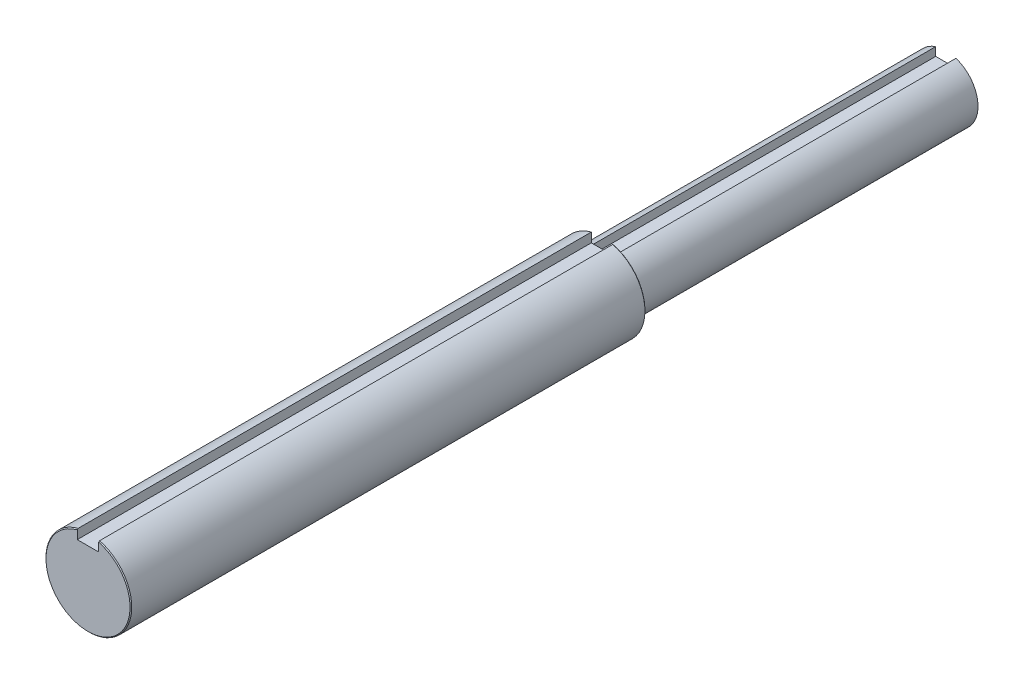
from build123d import *

# Parameters (mm, degrees)
BOSS_EXTRUDE1_DEPTH      = 304.8
BOSS_EXTRUDE1_DEPTH_BACK = 304.8
CHAMFER1_SIZE            = 0.254
SKETCH5_R                = 12.7
SKETCH5_R_2              = 9.525
CUT_EXTRUDE1_DEPTH       = 458.55264178
SKETCH6_W                = 6
SKETCH6_H                = 6
CUT_EXTRUDE2_DEPTH       = 458.55264178
CHAMFER2_SIZE            = 0.2
SKETCH7_R                = 63.5
CUT_EXTRUDE3_DEPTH       = 357.053282529


with BuildPart() as part:
    # Sketch3 → Boss-Extrude1 (new, two sides: drawn at the far end of the back side and taken through both)
    with BuildSketch(Plane.XY.offset(-BOSS_EXTRUDE1_DEPTH_BACK)):
        with BuildLine():
            Line((-3.175, 9.525), (-3.175, 12.296722124))
            ThreePointArc((-3.175, 12.296722124), (0, -12.7), (3.175, 12.296722124))
            Line((3.175, 12.296722124), (3.175, 9.525))
            Line((3.175, 9.525), (-3.175, 9.525))
        make_face()
    extrude(amount=BOSS_EXTRUDE1_DEPTH + BOSS_EXTRUDE1_DEPTH_BACK)

    # Chamfer1
    chamfer1_edges = [part.edges().sort_by_distance(p)[0] for p in [
        (0, -12.7, -304.8),
        (0, -12.7, 304.8),
    ]]
    chamfer(chamfer1_edges, length=CHAMFER1_SIZE)

    # Sketch5 → Cut-Extrude1 (cut, through all)
    with BuildSketch(Plane.XY.offset(152.4)):
        Circle(SKETCH5_R)
        Circle(SKETCH5_R_2, mode=Mode.SUBTRACT)
    extrude(amount=-CUT_EXTRUDE1_DEPTH, mode=Mode.SUBTRACT)

    # Sketch6 → Cut-Extrude2 (cut, through all)
    with BuildSketch(Plane.XY.offset(152.4)):
        with Locations((0, 9.525)):
            Rectangle(SKETCH6_W, SKETCH6_H)
    extrude(amount=-CUT_EXTRUDE2_DEPTH, mode=Mode.SUBTRACT)

    # Chamfer2
    chamfer2_edges = [part.edges().sort_by_distance(p)[0] for p in [
        (-3.175, 10.910861062, 152.4),
        (0, -12.7, 152.4),
        (3.175, 10.910861062, 152.4),
        (0, 9.525, 152.4),
        (0, -9.525, 152.4),
        (-3, 7.782611309, 152.4),
        (0, 6.525, 152.4),
        (3, 7.782611309, 152.4),
    ]]
    chamfer(chamfer2_edges, length=CHAMFER2_SIZE)

    # Sketch7 → Cut-Extrude3 (cut, through all)
    with BuildSketch(Plane.XY.offset(50.8)):
        Circle(SKETCH7_R)
    extrude(amount=-CUT_EXTRUDE3_DEPTH, mode=Mode.SUBTRACT)


solid = part.part
